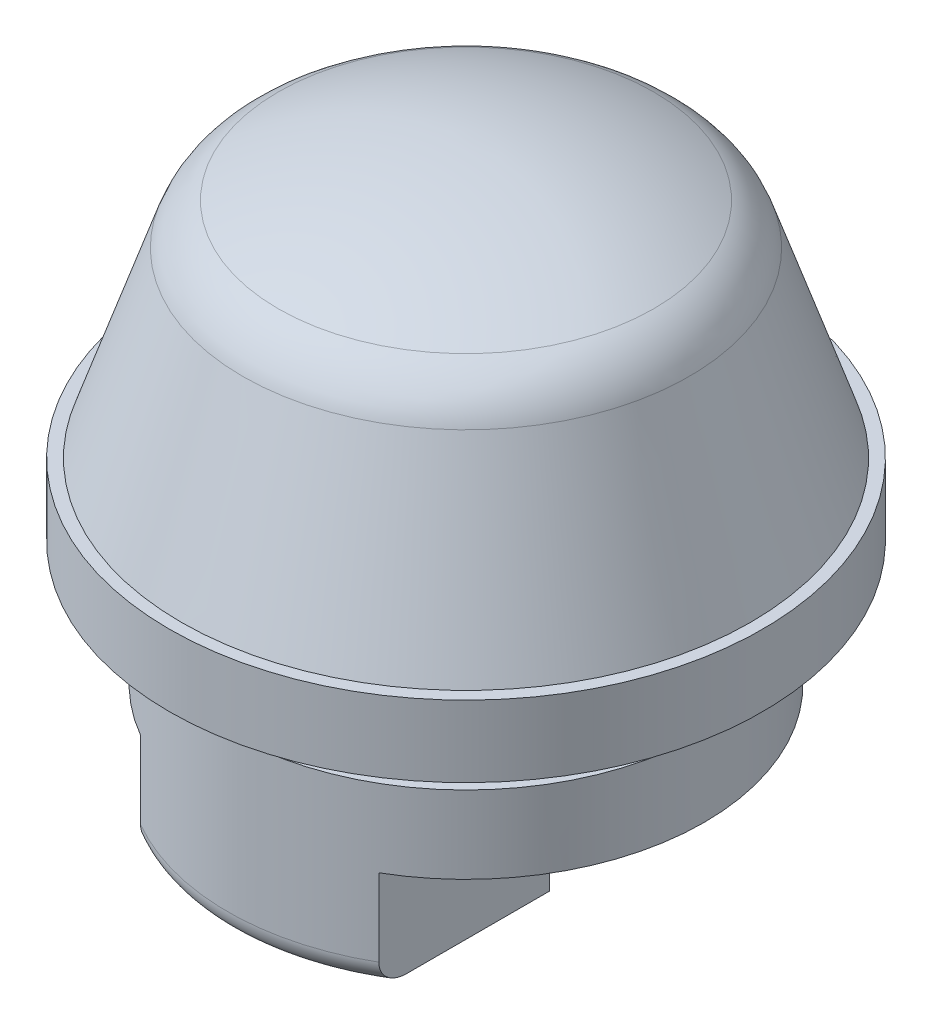
from build123d import *

# Parameters (mm, degrees)
FILLET1_R           = 6
SKETCH2_R           = 9
BOSS_EXTRUDE1_DEPTH = 4
SKETCH6_R           = 20
BOSS_EXTRUDE2_DEPTH = 15
SKETCH7_W           = 32.033376833
SKETCH7_H           = 34.641016152
SKETCH7_W_2         = 29.367708721
CUT_EXTRUDE1_DEPTH  = 8.5
CUT_EXTRUDE2_DEPTH  = 8.5
SKETCH10_R          = 7.1
CUT_EXTRUDE3_DEPTH  = 3
FILLET2_R           = 2


with BuildPart() as part:
    # Sketch1 → Revolve1 (revolve)
    with BuildSketch(Plane.XY, mode=Mode.PRIVATE) as revolve1_sk:
        with BuildLine():
            Line((0, 0), (0, 28.5))
            ThreePointArc((0, 28.5), (-9.340770846, 27.226775046), (-18, 23.5))
            Line((-18, 23.5), (-23.9, 6))
            Line((-23.9, 6), (-24.9, 6))
            Line((-24.9, 6), (-24.9, 0))
            Line((-24.9, 0), (0, 0))
        make_face()
    revolve(revolve1_sk.sketch.rotate(Axis((0, 0, 0), (0, 1, 0)), 270), axis=Axis((0, 0, 0), (0, 1, 0)))

    # Fillet1
    fillet1_edges = [part.edges().sort_by_distance(p)[0] for p in [
        (0, 23.5, 18),
    ]]
    fillet(fillet1_edges, radius=FILLET1_R)

    # Sketch2 → Boss-Extrude1 (add)
    with BuildSketch(Plane.XZ):
        with Locations(Location((0, 0, 0), (0, 0, 270))):
            Circle(SKETCH2_R)
    extrude(amount=BOSS_EXTRUDE1_DEPTH)

    # Sketch6 → Boss-Extrude2 (add)
    with BuildSketch(Plane.XZ.offset(4)):
        with Locations(Location((0, 0, 0), (0, 0, 270))):
            Circle(SKETCH6_R)
    extrude(amount=BOSS_EXTRUDE2_DEPTH)

    # Sketch7 → Cut-Extrude1 (cut)
    with BuildSketch(Plane.XZ.offset(19)):
        with Locations((-26.016688417, 0)):
            Rectangle(SKETCH7_W, SKETCH7_H)
        with Locations((24.68385436, 0)):
            Rectangle(SKETCH7_W_2, SKETCH7_H)
    extrude(amount=-CUT_EXTRUDE1_DEPTH, mode=Mode.SUBTRACT)

    # Sketch9 → Cut-Extrude2 (cut)
    with BuildSketch(Plane.XZ.offset(19)):
        with BuildLine():
            Line((-4.728636167, 3), (-27.5, 3))
            Line((-27.5, 3), (-27.5, -3))
            Line((-27.5, -3), (-4.728636167, -3))
            ThreePointArc((-4.728636167, -3), (0, -5.6), (4.728636167, -3))
            Line((4.728636167, -3), (27.5, -3))
            Line((27.5, -3), (27.5, 3))
            Line((27.5, 3), (4.728636167, 3))
            ThreePointArc((4.728636167, 3), (0, 5.6), (-4.728636167, 3))
        make_face()
    extrude(amount=-CUT_EXTRUDE2_DEPTH, mode=Mode.SUBTRACT)

    # Sketch10 → Cut-Extrude3 (cut)
    with BuildSketch(Plane.XZ.offset(19)):
        Circle(SKETCH10_R)
    extrude(amount=-CUT_EXTRUDE3_DEPTH, mode=Mode.SUBTRACT)

    # Fillet2
    fillet2_edges = [part.edges().sort_by_distance(p)[0] for p in [
        (0, -19, 20),
        (5.176380902, -19, -19.318516526),
    ]]
    fillet(fillet2_edges, radius=FILLET2_R)


solid = part.part
